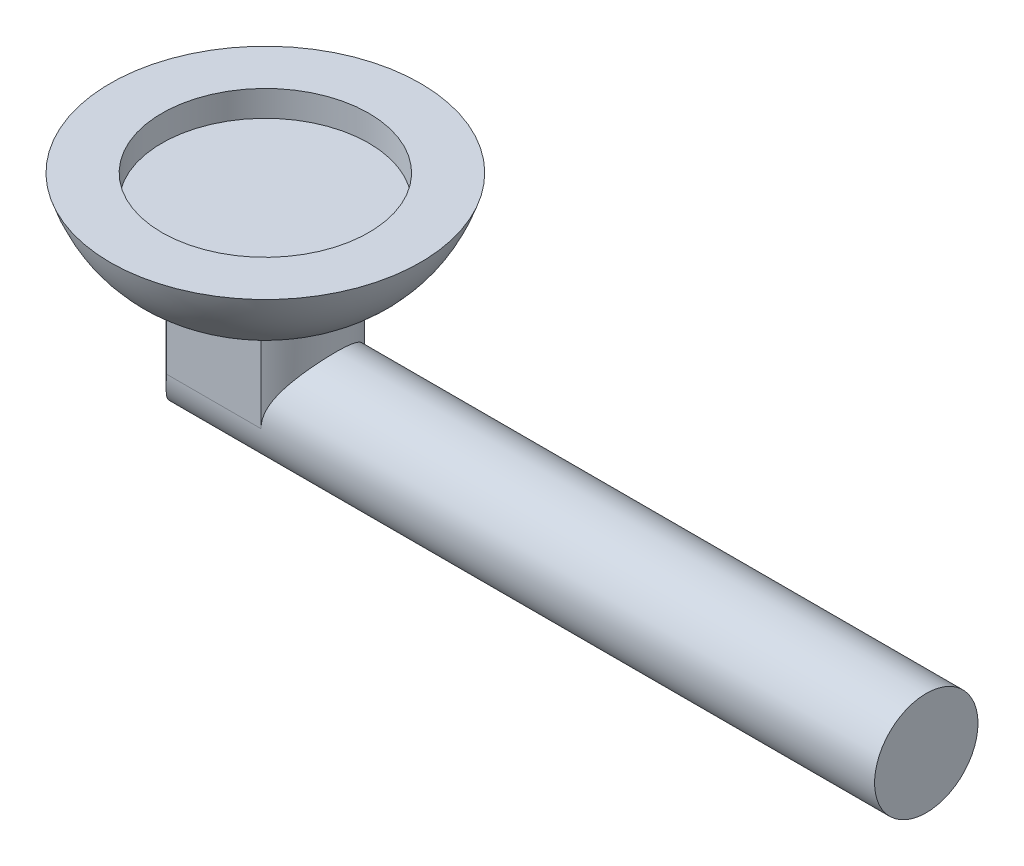
from build123d import *

# Parameters (mm, degrees)
BOSS_EXTRUDE1_DEPTH      = 50.8
BOSS_EXTRUDE1_DEPTH_BACK = 101.6
SKETCH2_R                = 12.7
CUT_EXTRUDE2_DEPTH       = 159.628919589
SKETCH4_R                = 25.4
CUT_EXTRUDE3_DEPTH       = 6.35


with BuildPart() as part:
    # Sketch1 → Revolve1 (revolve)
    with BuildSketch(Plane.XY, mode=Mode.PRIVATE) as revolve1_sk:
        with BuildLine():
            Line((28.184971871, 23.240239964), (-9.915028129, 23.240239964))
            Line((-9.915028129, 23.240239964), (-9.915028129, -36.426191716))
            Line((-9.915028129, -36.426191716), (7.305080495, -36.426191716))
            Line((7.305080495, -36.426191716), (7.305080495, 1.673808284))
            add(Edge.make_bspline(
                [(7.305080495, 1.673808284), (17.688890223, 5.05702424), (24.648854015, 12.2458348), (28.184971871, 23.240239964)],
                knots=[0.179471998, 0.179471998, 0.179471998, 0.179471998, 1, 1, 1, 1], degree=3))
        make_face()
    revolve(revolve1_sk.sketch.rotate(Axis((-9.915028129, 23.240239964, 0), (0, -1, 0)), 90), axis=Axis((-9.915028129, 23.240239964, 0), (0, -1, 0)))

    # Sketch2 → Boss-Extrude1 (add, two sides: drawn at the far end of the back side and taken through both)
    with BuildSketch(Plane(origin=(101.6, 0, 0), x_dir=(0, 0, -1), z_dir=(1, 0, 0)).offset(-BOSS_EXTRUDE1_DEPTH_BACK)):
        with Locations(Location((0, -18.998368254, 0), (0, 0, 180))):
            Circle(SKETCH2_R)
    extrude(amount=BOSS_EXTRUDE1_DEPTH + BOSS_EXTRUDE1_DEPTH_BACK)

    # Sketch3 → Cut-Extrude2 (cut, through all)
    with BuildSketch(Plane(origin=(101.6, 0, 0), x_dir=(0, 0, -1), z_dir=(1, 0, 0))):
        with BuildLine():
            Line((17.220108624, -36.426191716), (17.220108624, -18.998368254))
            Line((17.220108624, -18.998368254), (17.220108624, 1.673808284))
            Line((17.220108624, 1.673808284), (12.7, 1.673808284))
            Line((12.7, 1.673808284), (12.7, -18.998368254))
            ThreePointArc((12.7, -18.998368254), (0, -31.698368254), (-12.7, -18.998368254))
            Line((-12.7, -18.998368254), (-12.7, 1.673808284))
            Line((-12.7, 1.673808284), (-17.220108624, 1.673808284))
            Line((-17.220108624, 1.673808284), (-17.220108624, -18.998368254))
            Line((-17.220108624, -18.998368254), (-17.220108624, -36.426191716))
            Line((-17.220108624, -36.426191716), (17.220108624, -36.426191716))
        make_face()
    extrude(amount=-CUT_EXTRUDE2_DEPTH, mode=Mode.SUBTRACT)

    # Sketch4 → Cut-Extrude3 (cut)
    with BuildSketch(Plane(origin=(0, 23.240239964, 0), x_dir=(1, 0, 0), z_dir=(0, 1, 0))):
        with Locations(Location((-9.915028129, 0, 0), (0, 0, 270))):
            Circle(SKETCH4_R)
    extrude(amount=-CUT_EXTRUDE3_DEPTH, mode=Mode.SUBTRACT)


solid = part.part
